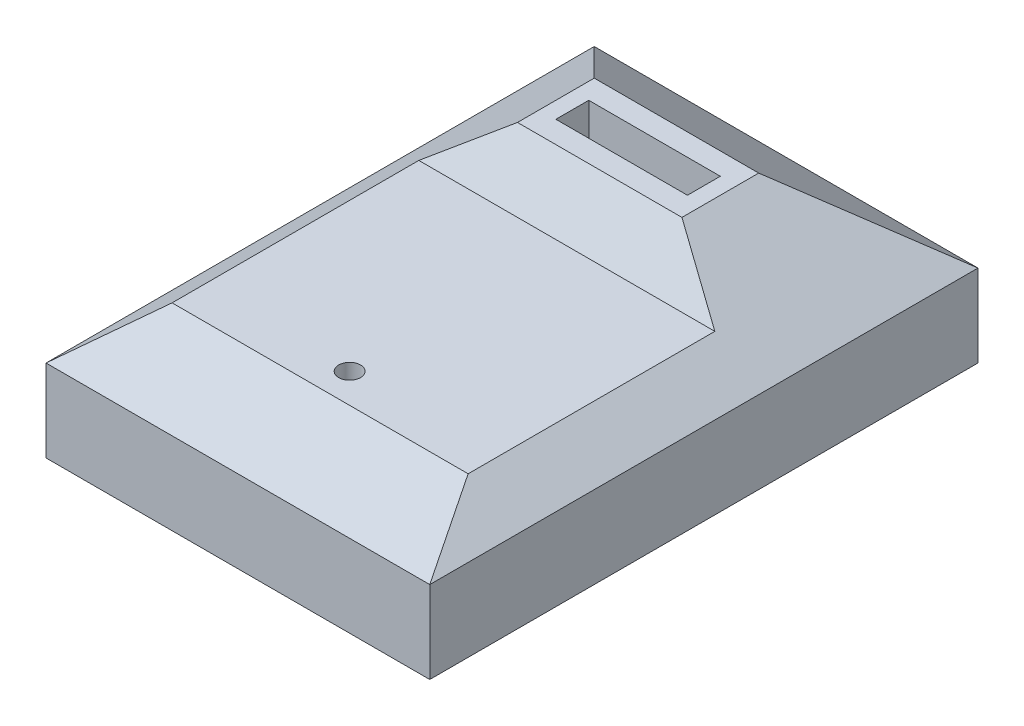
from build123d import *

# Parameters (mm, degrees)
SKIZZE1_W                       = 70
SKIZZE1_H                       = 30
AUFSATZ_LINEAR_AUSTRAGEN1_DEPTH = 100
SCHNITT_LINEAR_AUSTRAGEN2_DEPTH = 126.6980509
SCHNITT_LINEAR_AUSTRAGEN3_DEPTH = 100
SCHNITT_LINEAR_AUSTRAGEN4_DEPTH = 126.6980509
WANDUNG1_T                      = -2
SKIZZE10_R                      = 3
AUFSATZ_LINEAR_AUSTRAGEN2_DEPTH = 2
SKIZZE12_R                      = 2
AUFSATZ_LINEAR_AUSTRAGEN3_DEPTH = 5
SKIZZE13_R                      = 1.5
SCHNITT_LINEAR_AUSTRAGEN5_DEPTH = 124.385574521
SKIZZE15_R                      = 2
SCHNITT_LINEAR_AUSTRAGEN6_DEPTH = 3
SKIZZE26_W                      = 26
SKIZZE26_H                      = 8
AUFSATZ_LINEAR_AUSTRAGEN4_DEPTH = 30
SKIZZE27_W                      = 24
SKIZZE27_H                      = 6
SCHNITT_LINEAR_AUSTRAGEN8_DEPTH = 28
SCHNITT_LINEAR_AUSTRAGEN9_REACH = 127.698
SKIZZE28_W                      = 9
SKIZZE28_H                      = 4


with BuildPart() as part:
    # Skizze1 → Aufsatz-Linear austragen1 (new body)
    with BuildSketch(Plane.XY):
        with Locations((35, 15)):
            Rectangle(SKIZZE1_W, SKIZZE1_H)
    extrude(amount=AUFSATZ_LINEAR_AUSTRAGEN1_DEPTH)

    # Skizze4 → Schnitt-Linear austragen2 (cut, through all)
    with BuildSketch(Plane(origin=(70, 0, 0), x_dir=(0, 0, -1), z_dir=(1, 0, 0))):
        Polygon((0, 15), (-20, 30), (0, 30), align=None)
    extrude(amount=-SCHNITT_LINEAR_AUSTRAGEN2_DEPTH, mode=Mode.SUBTRACT)

    # Skizze5 → Schnitt-Linear austragen3 (cut)
    with BuildSketch(Plane.XY.offset(100)):
        Polygon((0, 30), (20, 30), (0, 15), align=None)
        Polygon((70, 30), (50, 30), (70, 15), align=None)
    extrude(amount=-SCHNITT_LINEAR_AUSTRAGEN3_DEPTH, mode=Mode.SUBTRACT)

    # Skizze8 → Schnitt-Linear austragen4 (cut, through all)
    with BuildSketch(Plane(origin=(70, 0, 0), x_dir=(0, 0, -1), z_dir=(1, 0, 0))):
        Polygon((-100, 30), (-100, 15), (-85, 21), (-40, 21), (-34, 30), align=None)
    extrude(amount=-SCHNITT_LINEAR_AUSTRAGEN4_DEPTH, mode=Mode.SUBTRACT)

    # Wandung1
    wandung1_openings = [part.faces().sort_by_distance(p)[0] for p in [
        (35, 0, 50),
    ]]
    offset(amount=WANDUNG1_T, openings=wandung1_openings, kind=Kind.INTERSECTION)

    # Skizze10 → Aufsatz-Linear austragen2 (add)
    with BuildSketch(Plane.XZ.offset(-19)):
        with Locations((35, 79.614835193)):
            Circle(SKIZZE10_R)
    extrude(amount=AUFSATZ_LINEAR_AUSTRAGEN2_DEPTH)

    # Skizze12 → Aufsatz-Linear austragen3 (add)
    with BuildSketch(Plane.XZ.offset(-17)):
        with Locations((35, 79.614835193)):
            Circle(SKIZZE12_R)
    extrude(amount=AUFSATZ_LINEAR_AUSTRAGEN3_DEPTH)

    # Skizze13 → Schnitt-Linear austragen5 (cut, through all)
    with BuildSketch(Plane.XZ.offset(-12)):
        with Locations((35, 79.614835193)):
            Circle(SKIZZE13_R)
    extrude(amount=-SCHNITT_LINEAR_AUSTRAGEN5_DEPTH, mode=Mode.SUBTRACT)

    # Skizze15 → Schnitt-Linear austragen6 (cut)
    with BuildSketch(Plane(origin=(0, 21, 0), x_dir=(1, 0, 0), z_dir=(0, 1, 0))):
        with Locations((35, -79.614835193)):
            Circle(SKIZZE15_R)
    extrude(amount=-SCHNITT_LINEAR_AUSTRAGEN6_DEPTH, mode=Mode.SUBTRACT)

    # Skizze26 → Aufsatz-Linear austragen4 (add)
    with BuildSketch(Plane(origin=(0, 30, 0), x_dir=(1, 0, 0), z_dir=(0, 1, 0))):
        with Locations((35, -27)):
            Rectangle(SKIZZE26_W, SKIZZE26_H)
    extrude(amount=-AUFSATZ_LINEAR_AUSTRAGEN4_DEPTH)

    # Skizze27 → Schnitt-Linear austragen8 (cut)
    with BuildSketch(Plane(origin=(0, 30, 0), x_dir=(1, 0, 0), z_dir=(0, 1, 0))):
        with Locations((35, -27)):
            Rectangle(SKIZZE27_W, SKIZZE27_H)
    extrude(amount=-SCHNITT_LINEAR_AUSTRAGEN8_DEPTH, mode=Mode.SUBTRACT)

    # Skizze28 → Schnitt-Linear austragen9 (cut, up to next)
    with BuildSketch(Plane.XZ, mode=Mode.PRIVATE) as schnitt_linear_austragen9_sk1:
        with Locations((41.5, 27)):
            Rectangle(SKIZZE28_W, SKIZZE28_H)
    schnitt_linear_austragen9_tool1 = extrude(schnitt_linear_austragen9_sk1.sketch, amount=-SCHNITT_LINEAR_AUSTRAGEN9_REACH, mode=Mode.PRIVATE) & part.part
    add(schnitt_linear_austragen9_tool1.solids().sort_by_distance((41.5, 0, 27))[0], mode=Mode.SUBTRACT)


solid = part.part
